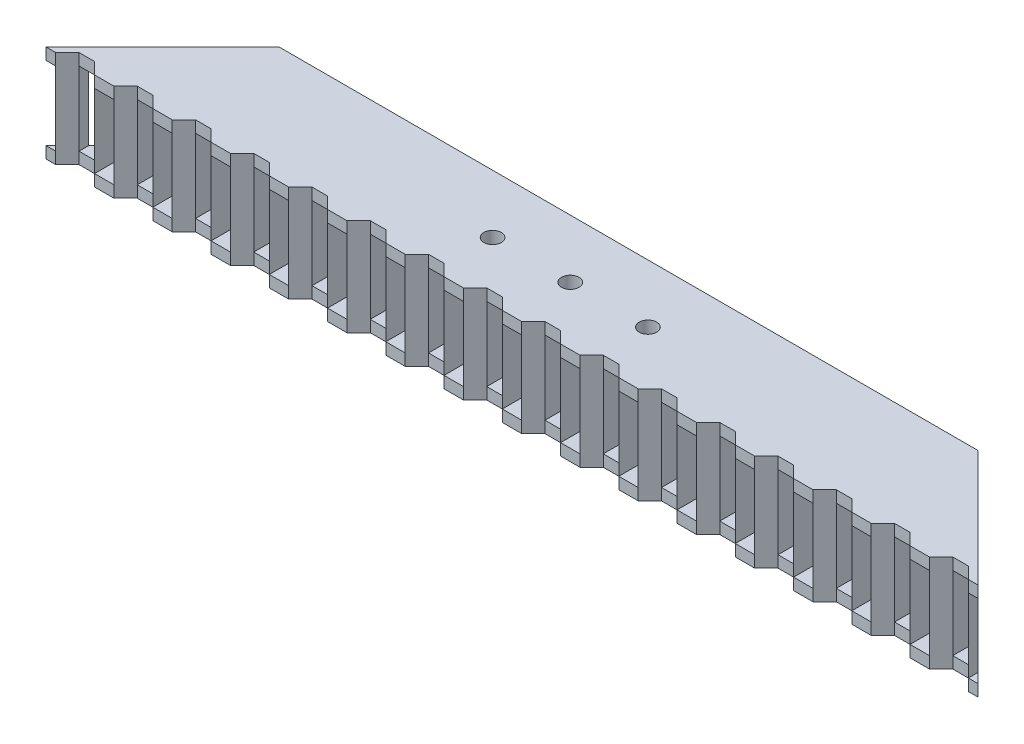
from build123d import *

# Parameters (mm, degrees)
SKETCH1_R           = 2.25
BOSS_EXTRUDE1_DEPTH = 25
CUT_EXTRUDE1_DEPTH  = 25
SKETCH3_W           = 5
SKETCH3_H           = 19
SKETCH3_W_2         = 10.819921476
CUT_EXTRUDE2_DEPTH  = 51
SKETCH4_W           = 4
SKETCH4_H           = 19
CUT_EXTRUDE3_DEPTH  = 51
BOSS_EXTRUDE4_START = -24
SKETCH5_R           = 7
SKETCH5_R_2         = 2.25
BOSS_EXTRUDE4_DEPTH = 24


with BuildPart() as part:
    # Sketch1 → Boss-Extrude1 (new body)
    with BuildSketch(Plane(origin=(0, 0, 0), x_dir=(1, 0, 0), z_dir=(0, 1, 0))):
        Polygon((0, 0), (-120, 0), (-90, 30), (90, 30), (120, 0), align=None)
        with Locations(Location((0, 15, 0), (0, 0, 270))):
            Circle(SKETCH1_R, mode=Mode.SUBTRACT)
        with Locations(Location((-20, 15, 0), (0, 0, 270))):
            Circle(SKETCH1_R, mode=Mode.SUBTRACT)
        with Locations(Location((20, 15, 0), (0, 0, 270))):
            Circle(SKETCH1_R, mode=Mode.SUBTRACT)
    extrude(amount=BOSS_EXTRUDE1_DEPTH)

    # Sketch2 → Cut-Extrude1 (cut)
    with BuildSketch(Plane(origin=(0, 25, 0), x_dir=(1, 0, 0), z_dir=(0, 1, 0))):
        Polygon((110.5, 3), (107.5, 0), (117.5, 0), (114.5, 3), align=None)
        Polygon((95.5, 3), (92.5, 0), (102.5, 0), (99.5, 3), align=None)
        Polygon((80.5, 3), (77.5, 0), (87.5, 0), (84.5, 3), align=None)
        Polygon((65.5, 3), (62.5, 0), (72.5, 0), (69.5, 3), align=None)
        Polygon((50.5, 3), (47.5, 0), (57.5, 0), (54.5, 3), align=None)
        Polygon((35.5, 3), (32.5, 0), (42.5, 0), (39.5, 3), align=None)
        Polygon((20.5, 3), (17.5, 0), (27.5, 0), (24.5, 3), align=None)
        Polygon((5.5, 3), (2.5, 0), (12.5, 0), (9.5, 3), align=None)
        Polygon((-12.5, 0), (-2.5, 0), (-5.5, 3), (-9.5, 3), align=None)
        Polygon((-27.5, 0), (-17.5, 0), (-20.5, 3), (-24.5, 3), align=None)
        Polygon((-42.5, 0), (-32.5, 0), (-35.5, 3), (-39.5, 3), align=None)
        Polygon((-57.5, 0), (-47.5, 0), (-50.5, 3), (-54.5, 3), align=None)
        Polygon((-72.5, 0), (-62.5, 0), (-65.5, 3), (-69.5, 3), align=None)
        Polygon((-87.5, 0), (-77.5, 0), (-80.5, 3), (-84.5, 3), align=None)
        Polygon((-102.5, 0), (-92.5, 0), (-95.5, 3), (-99.5, 3), align=None)
        Polygon((-117.5, 0), (-107.5, 0), (-110.5, 3), (-114.5, 3), align=None)
    extrude(amount=-CUT_EXTRUDE1_DEPTH, mode=Mode.SUBTRACT)

    # Sketch3 → Cut-Extrude2 (cut)
    with BuildSketch(Plane.XY):
        with Locations((-105, 12.5)):
            Rectangle(SKETCH3_W, SKETCH3_H)
        with Locations((-90, 12.5)):
            Rectangle(SKETCH3_W, SKETCH3_H)
        with Locations((-75, 12.5)):
            Rectangle(SKETCH3_W, SKETCH3_H)
        with Locations((-60, 12.5)):
            Rectangle(SKETCH3_W, SKETCH3_H)
        with Locations((-45, 12.5)):
            Rectangle(SKETCH3_W, SKETCH3_H)
        with Locations((-30, 12.5)):
            Rectangle(SKETCH3_W, SKETCH3_H)
        with Locations((-15, 12.5)):
            Rectangle(SKETCH3_W, SKETCH3_H)
        with Locations((0, 12.5)):
            Rectangle(SKETCH3_W, SKETCH3_H)
        with Locations((15, 12.5)):
            Rectangle(SKETCH3_W, SKETCH3_H)
        with Locations((30, 12.5)):
            Rectangle(SKETCH3_W, SKETCH3_H)
        with Locations((45, 12.5)):
            Rectangle(SKETCH3_W, SKETCH3_H)
        with Locations((60, 12.5)):
            Rectangle(SKETCH3_W, SKETCH3_H)
        with Locations((75, 12.5)):
            Rectangle(SKETCH3_W, SKETCH3_H)
        with Locations((90, 12.5)):
            Rectangle(SKETCH3_W, SKETCH3_H)
        with Locations((105, 12.5)):
            Rectangle(SKETCH3_W, SKETCH3_H)
        with Locations((120, 12.5)):
            Rectangle(SKETCH3_W, SKETCH3_H)
        with Locations((-122.909960738, 12.5)):
            Rectangle(SKETCH3_W_2, SKETCH3_H)
    extrude(amount=-CUT_EXTRUDE2_DEPTH, mode=Mode.SUBTRACT)

    # Sketch4 → Cut-Extrude3 (cut)
    with BuildSketch(Plane.XY.offset(-3)):
        with Locations((-112.5, 12.5)):
            Rectangle(SKETCH4_W, SKETCH4_H)
        with Locations((-97.5, 12.5)):
            Rectangle(SKETCH4_W, SKETCH4_H)
        with Locations((-82.5, 12.5)):
            Rectangle(SKETCH4_W, SKETCH4_H)
        with Locations((-67.5, 12.5)):
            Rectangle(SKETCH4_W, SKETCH4_H)
        with Locations((-52.5, 12.5)):
            Rectangle(SKETCH4_W, SKETCH4_H)
        with Locations((-37.5, 12.5)):
            Rectangle(SKETCH4_W, SKETCH4_H)
        with Locations((-22.5, 12.5)):
            Rectangle(SKETCH4_W, SKETCH4_H)
        with Locations((-7.5, 12.5)):
            Rectangle(SKETCH4_W, SKETCH4_H)
        with Locations((7.5, 12.5)):
            Rectangle(SKETCH4_W, SKETCH4_H)
        with Locations((22.5, 12.5)):
            Rectangle(SKETCH4_W, SKETCH4_H)
        with Locations((37.5, 12.5)):
            Rectangle(SKETCH4_W, SKETCH4_H)
        with Locations((52.5, 12.5)):
            Rectangle(SKETCH4_W, SKETCH4_H)
        with Locations((67.5, 12.5)):
            Rectangle(SKETCH4_W, SKETCH4_H)
        with Locations((82.5, 12.5)):
            Rectangle(SKETCH4_W, SKETCH4_H)
        with Locations((97.5, 12.5)):
            Rectangle(SKETCH4_W, SKETCH4_H)
        with Locations((112.5, 12.5)):
            Rectangle(SKETCH4_W, SKETCH4_H)
    extrude(amount=-CUT_EXTRUDE3_DEPTH, mode=Mode.SUBTRACT)

    # Sketch5 → Boss-Extrude4 (add)
    # profile 1 of 3: a face of its own
    with BuildSketch(Plane(origin=(0, 25, 0), x_dir=(1, 0, 0), z_dir=(0, 1, 0)).offset(BOSS_EXTRUDE4_START)):
        with Locations((-20, 15)):
            Circle(SKETCH5_R)
        with Locations(Location((-20, 15, 0), (0, 0, 270))):
            Circle(SKETCH5_R_2, mode=Mode.SUBTRACT)
    # profile 2 of 3: a face of its own
    with BuildSketch(Plane(origin=(0, 25, 0), x_dir=(1, 0, 0), z_dir=(0, 1, 0)).offset(BOSS_EXTRUDE4_START)):
        with Locations((0, 15)):
            Circle(SKETCH5_R)
        with Locations(Location((0, 15, 0), (0, 0, 270))):
            Circle(SKETCH5_R_2, mode=Mode.SUBTRACT)
    # profile 3 of 3: a face of its own
    with BuildSketch(Plane(origin=(0, 25, 0), x_dir=(1, 0, 0), z_dir=(0, 1, 0)).offset(BOSS_EXTRUDE4_START)):
        with Locations((20, 15)):
            Circle(SKETCH5_R)
        with Locations(Location((20, 15, 0), (0, 0, 270))):
            Circle(SKETCH5_R_2, mode=Mode.SUBTRACT)
    extrude(amount=BOSS_EXTRUDE4_DEPTH)


solid = part.part
